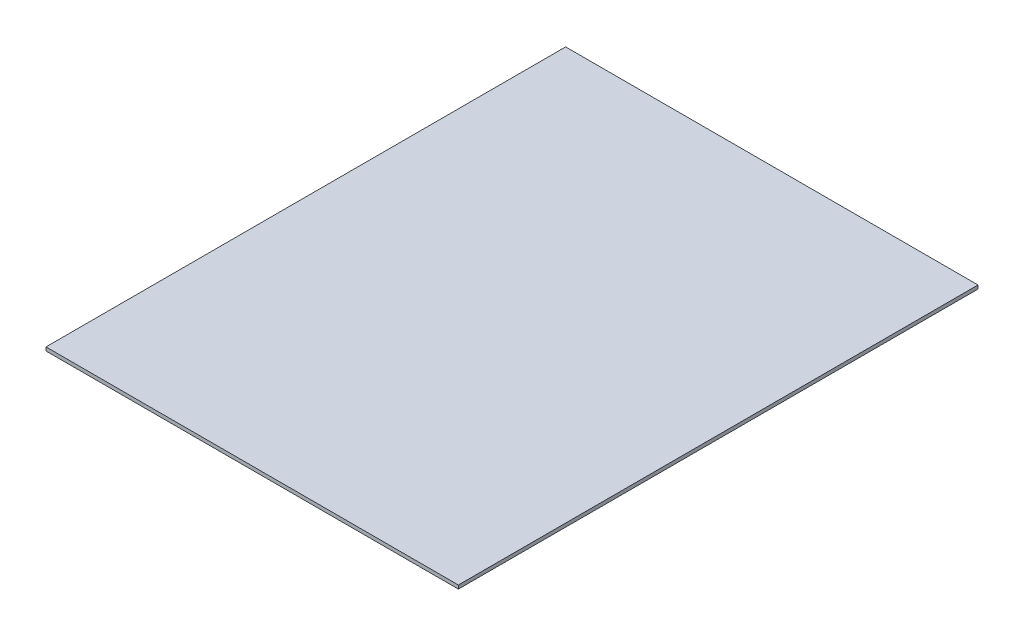
from build123d import *

# Parameters (mm, degrees)
SKETCH1_W           = 346
SKETCH1_H           = 436
BOSS_EXTRUDE1_DEPTH = 3


with BuildPart() as part:
    # Sketch1 → Boss-Extrude1 (new body)
    with BuildSketch(Plane(origin=(0, 0, 0), x_dir=(1, 0, 0), z_dir=(0, 1, 0))):
        with Locations((-173, 218)):
            Rectangle(SKETCH1_W, SKETCH1_H)
    extrude(amount=BOSS_EXTRUDE1_DEPTH)


solid = part.part
